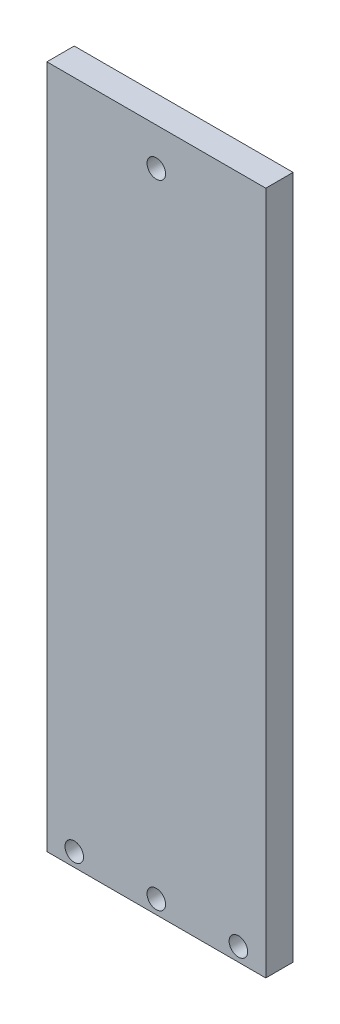
from build123d import *

# Parameters (mm, degrees)
SKETCH1_R           = 2.15265
BOSS_EXTRUDE1_DEPTH = 3.175


with BuildPart() as part:
    # Sketch1 → Boss-Extrude1 (new, symmetric)
    with BuildSketch(Plane.XY):
        Polygon((-25.4, -76.2), (-25.4, -82.55), (25.4, -82.55), (25.4, -76.2), (25.4, 76.2), (-25.4, 76.2), align=None)
        with Locations((0, 67.4497)):
            Circle(SKETCH1_R, mode=Mode.SUBTRACT)
        with Locations((-19.05, -79.375)):
            Circle(SKETCH1_R, mode=Mode.SUBTRACT)
        with Locations((0, -79.375)):
            Circle(SKETCH1_R, mode=Mode.SUBTRACT)
        with Locations((19.05, -79.375)):
            Circle(SKETCH1_R, mode=Mode.SUBTRACT)
    extrude(amount=BOSS_EXTRUDE1_DEPTH, both=True)


solid = part.part
